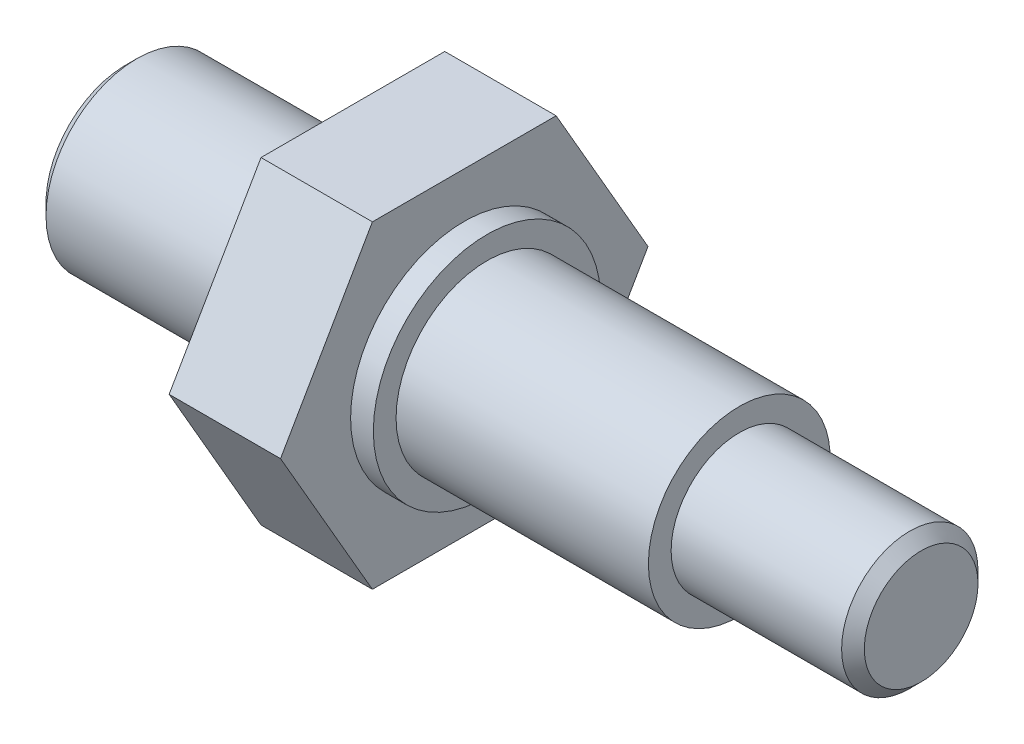
from build123d import *

# Parameters (mm, degrees)
BOSS_EXTRUDE1_START = -10
BOSS_EXTRUDE1_DEPTH = 35
CHAMFER1_SIZE       = 0.5


with BuildPart() as part:
    # Sketch1 → Boss-Extrude1 (new body)
    with BuildSketch(Plane(origin=(0, 0, 0), x_dir=(0, 0, -1), z_dir=(1, 0, 0)).offset(BOSS_EXTRUDE1_START)):
        Polygon((-8.0829, 0), (-4.04145, -6.999996736), (4.04145, -6.999996736), (8.0829, 0), (4.04145, 6.999996736), (-4.04145, 6.999996736), align=None)
    extrude(amount=BOSS_EXTRUDE1_DEPTH)

    # Sketch2 → Cut-Revolve1 (revolve, cut)
    with BuildSketch(Plane(origin=(0, 0, 0), x_dir=(1, 0, 0), z_dir=(0, 1, 0)), mode=Mode.PRIVATE) as cut_revolve1_sk:
        Polygon((0, 8.0829), (-10, 8.0829), (-10, 4), (-1, 4), (-1, 3.45), (0, 3.45), align=None)
    revolve(cut_revolve1_sk.sketch.rotate(Axis((-12.627683811, 0, 0), (1, 0, 0)), 180), axis=Axis((-12.627683811, 0, 0), (1, 0, 0)), mode=Mode.SUBTRACT)

    # Sketch3 → Cut-Revolve2 (revolve, cut)
    with BuildSketch(Plane(origin=(0, 0, 0), x_dir=(1, 0, 0), z_dir=(0, 1, 0)), mode=Mode.PRIVATE) as cut_revolve2_sk:
        Polygon((25, 8.0829), (25, 3), (17, 3), (17, 4), (5.9, 4), (5.9, 5), (4.9, 5), (4.9, 8.0829), align=None)
    revolve(cut_revolve2_sk.sketch.rotate(Axis((-14.24617289, 0, 0), (1, 0, 0)), 180), axis=Axis((-14.24617289, 0, 0), (1, 0, 0)), mode=Mode.SUBTRACT)

    # Chamfer1
    chamfer1_edges = [part.edges().sort_by_distance(p)[0] for p in [
        (-10, 0, -4),
        (25, 0, -3),
    ]]
    chamfer(chamfer1_edges, length=CHAMFER1_SIZE)


solid = part.part
